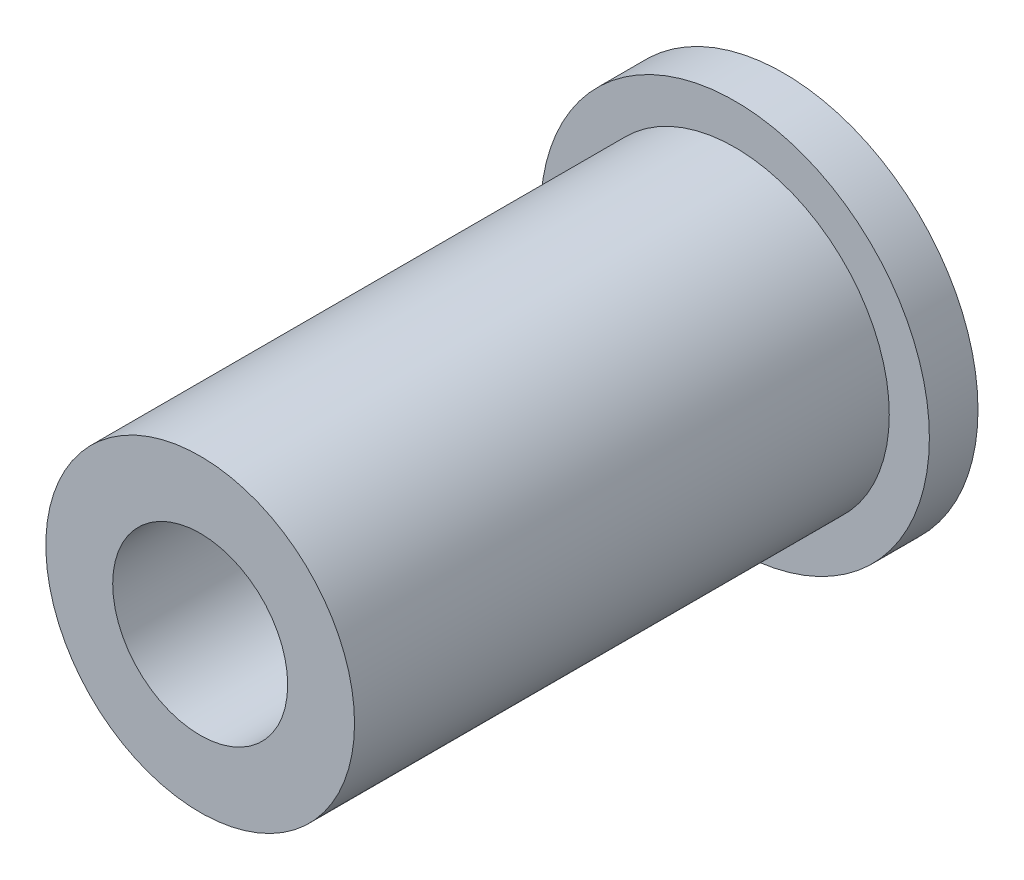
from build123d import *

# Parameters (mm, degrees)
SKETCH1_R           = 4
BOSS_EXTRUDE1_DEPTH = 12
CUT_EXTRUDE1_START  = -11
SKETCH2_R           = 4
SKETCH2_R_2         = 3.175
CUT_EXTRUDE1_DEPTH  = 11
SKETCH5_R           = 1.8
CUT_EXTRUDE2_DEPTH  = 14.266499161
SKETCH6_R           = 2.8
CUT_EXTRUDE3_DEPTH  = 4.5


with BuildPart() as part:
    # Sketch1 → Boss-Extrude1 (new body)
    with BuildSketch(Plane.XY):
        Circle(SKETCH1_R)
    extrude(amount=BOSS_EXTRUDE1_DEPTH)

    # Sketch2 → Cut-Extrude1 (cut)
    with BuildSketch(Plane.XY.offset(12).offset(CUT_EXTRUDE1_START)):
        Circle(SKETCH2_R)
        Circle(SKETCH2_R_2, mode=Mode.SUBTRACT)
    extrude(amount=CUT_EXTRUDE1_DEPTH, mode=Mode.SUBTRACT)

    # Sketch5 → Cut-Extrude2 (cut, through all)
    with BuildSketch(Plane(origin=(0, 0, 0), x_dir=(-1, 0, 0), z_dir=(0, 0, -1))):
        Circle(SKETCH5_R)
    extrude(amount=-CUT_EXTRUDE2_DEPTH, mode=Mode.SUBTRACT)

    # Sketch6 → Cut-Extrude3 (cut)
    with BuildSketch(Plane(origin=(0, 0, 0), x_dir=(-1, 0, 0), z_dir=(0, 0, -1))):
        Circle(SKETCH6_R)
    extrude(amount=-CUT_EXTRUDE3_DEPTH, mode=Mode.SUBTRACT)


solid = part.part
